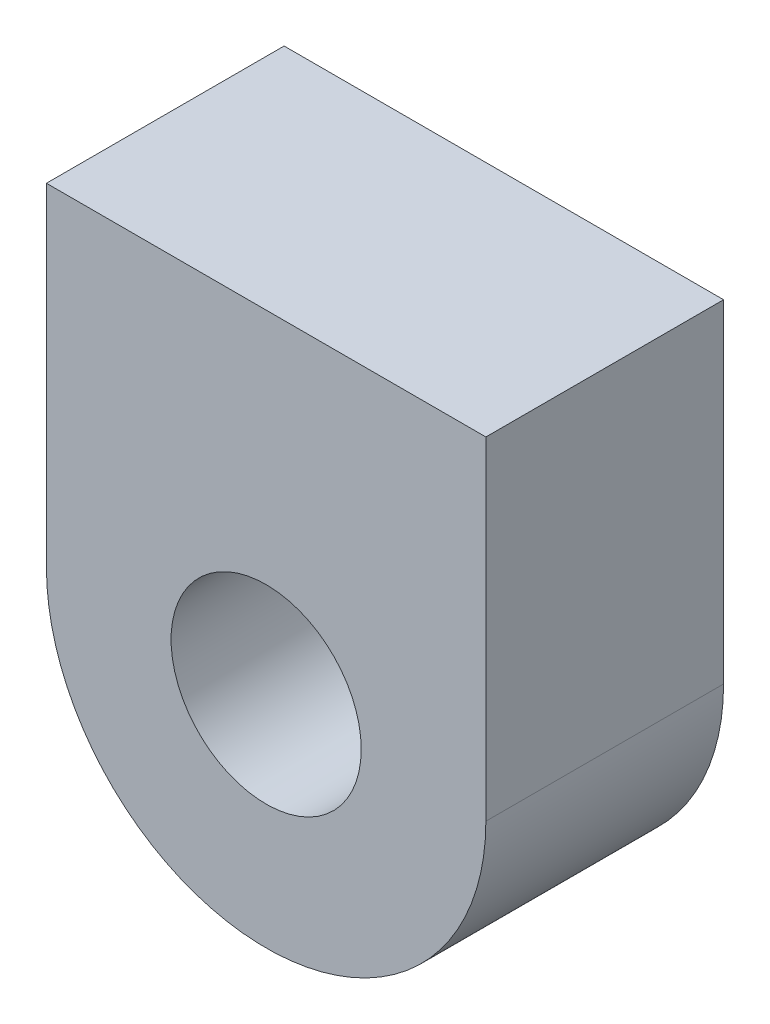
from build123d import *

# Parameters (mm, degrees)
SKETCH3_R           = 2
BOSS_EXTRUDE2_DEPTH = 5


with BuildPart() as part:
    # Sketch3 → Boss-Extrude2 (new body)
    with BuildSketch(Plane.XY):
        with BuildLine():
            Line((-4.622026219, 7), (-4.622026219, 0))
            ThreePointArc((-4.622026219, 0), (0, -4.622026219), (4.622026219, 0))
            Line((4.622026219, 0), (4.622026219, 7))
            Line((4.622026219, 7), (-4.622026219, 7))
        make_face()
        Circle(SKETCH3_R, mode=Mode.SUBTRACT)
    extrude(amount=BOSS_EXTRUDE2_DEPTH)


solid = part.part
